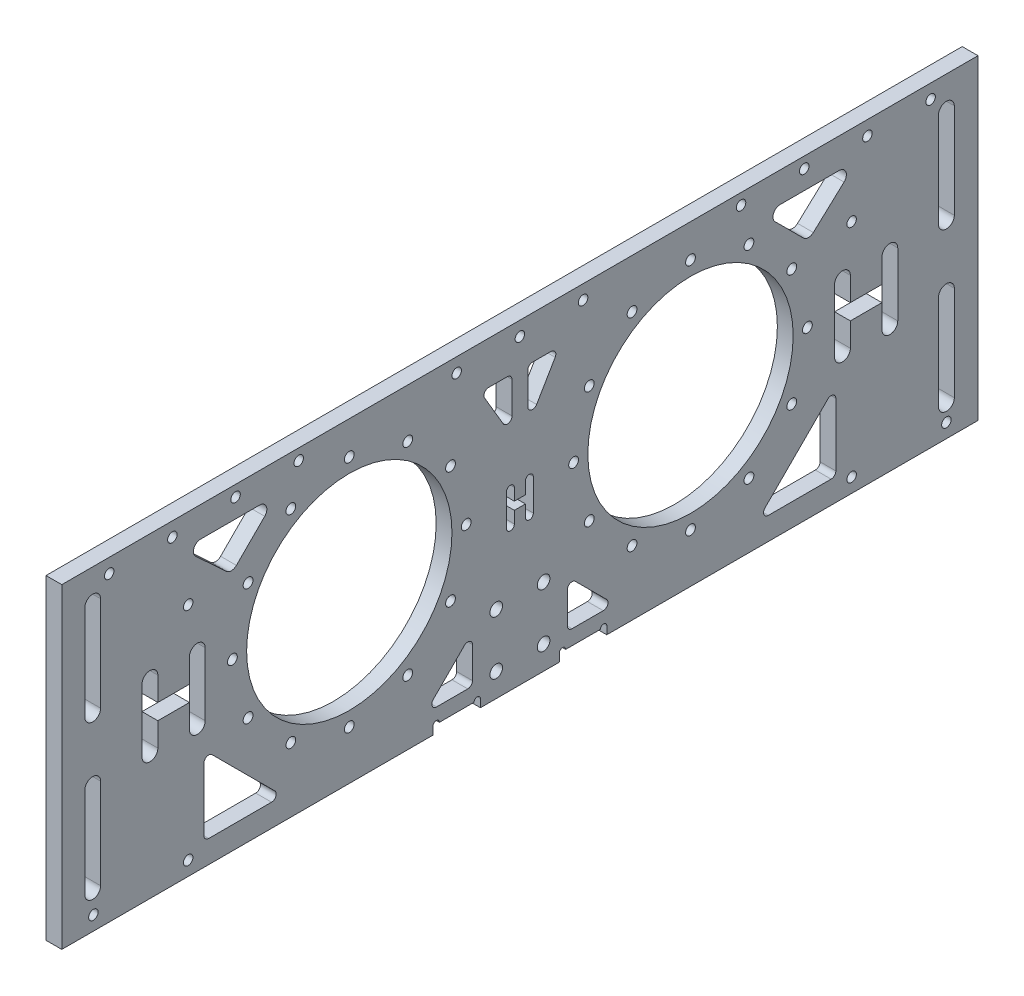
from build123d import *

# Parameters (mm, degrees)
SKETCH_1_W          = 288
SKETCH_1_H          = 101
SKETCH_1_R          = 32.5
SKETCH_1_R_2        = 1.55
SKETCH_1_R_3        = 2
SKETCH_1_R_4        = 1.5
EXTRUDE_1_DEPTH     = 5
SKETCH_2_R          = 1.5
CUT_EXTRUDE_1_DEPTH = 206.031704865
SKETCH_3_R          = 1.5
CUT_EXTRUDE_2_DEPTH = 10
CUT_EXTRUDE_3_DEPTH = 206.031704865
CUT_EXTRUDE_4_DEPTH = 206.031704865
SKETCH_8_W          = 1
SKETCH_8_H          = 101
EXTRUDE_3_DEPTH     = 5
SKETCH_9_W          = 290
SKETCH_9_H          = 0.5
CUT_EXTRUDE_5_DEPTH = 10
CUT_EXTRUDE_6_DEPTH = 10
CUT_EXTRUDE_7_DEPTH = 10
CUT_EXTRUDE_8_DEPTH = 10


with BuildPart() as part:
    # 草图1 → 凸台-拉伸1 (new body)
    with BuildSketch(Plane(origin=(0, 0, 0), x_dir=(0, 0, -1), z_dir=(1, 0, 0))):
        with Locations((54, -2.5)):
            Rectangle(SKETCH_1_W, SKETCH_1_H)
        Circle(SKETCH_1_R, mode=Mode.SUBTRACT)
        with Locations((0, 37)):
            Circle(SKETCH_1_R_2, mode=Mode.SUBTRACT)
        with Locations((18.5, 32.04293994)):
            Circle(SKETCH_1_R_2, mode=Mode.SUBTRACT)
        with Locations((32.04293994, 18.5)):
            Circle(SKETCH_1_R_2, mode=Mode.SUBTRACT)
        with Locations((37, 0)):
            Circle(SKETCH_1_R_2, mode=Mode.SUBTRACT)
        with Locations((32.04293994, -18.5)):
            Circle(SKETCH_1_R_2, mode=Mode.SUBTRACT)
        with Locations((18.5, -32.04293994)):
            Circle(SKETCH_1_R_2, mode=Mode.SUBTRACT)
        with Locations((0, -37)):
            Circle(SKETCH_1_R_2, mode=Mode.SUBTRACT)
        with Locations((-18.5, -32.04293994)):
            Circle(SKETCH_1_R_2, mode=Mode.SUBTRACT)
        with Locations((-32.04293994, -18.5)):
            Circle(SKETCH_1_R_2, mode=Mode.SUBTRACT)
        with Locations((-37, 0)):
            Circle(SKETCH_1_R_2, mode=Mode.SUBTRACT)
        with Locations((-32.04293994, 18.5)):
            Circle(SKETCH_1_R_2, mode=Mode.SUBTRACT)
        with Locations((-18.5, 32.04293994)):
            Circle(SKETCH_1_R_2, mode=Mode.SUBTRACT)
        with Locations(Location((126.5, 32.04293994, 0), (0, 0, 180))):
            Circle(SKETCH_1_R_2, mode=Mode.SUBTRACT)
        with Locations(Location((140.04293994, 18.5, 0), (0, 0, 180))):
            Circle(SKETCH_1_R_2, mode=Mode.SUBTRACT)
        with Locations(Location((145, 0, 0), (0, 0, 180))):
            Circle(SKETCH_1_R_2, mode=Mode.SUBTRACT)
        with Locations(Location((140.04293994, -18.5, 0), (0, 0, 180))):
            Circle(SKETCH_1_R_2, mode=Mode.SUBTRACT)
        with Locations(Location((126.5, -32.04293994, 0), (0, 0, 180))):
            Circle(SKETCH_1_R_2, mode=Mode.SUBTRACT)
        with Locations(Location((108, -37, 0), (0, 0, 180))):
            Circle(SKETCH_1_R_2, mode=Mode.SUBTRACT)
        with Locations(Location((89.5, -32.04293994, 0), (0, 0, 180))):
            Circle(SKETCH_1_R_2, mode=Mode.SUBTRACT)
        with Locations(Location((75.95706006, -18.5, 0), (0, 0, 180))):
            Circle(SKETCH_1_R_2, mode=Mode.SUBTRACT)
        with Locations(Location((71, 0, 0), (0, 0, 180))):
            Circle(SKETCH_1_R_2, mode=Mode.SUBTRACT)
        with Locations(Location((75.95706006, 18.5, 0), (0, 0, 180))):
            Circle(SKETCH_1_R_2, mode=Mode.SUBTRACT)
        with Locations(Location((89.5, 32.04293994, 0), (0, 0, 180))):
            Circle(SKETCH_1_R_2, mode=Mode.SUBTRACT)
        with Locations(Location((108, 37, 0), (0, 0, 180))):
            Circle(SKETCH_1_R_2, mode=Mode.SUBTRACT)
        with Locations(Location((108, 0, 0), (0, 0, 180))):
            Circle(SKETCH_1_R, mode=Mode.SUBTRACT)
        with Locations((61.5, -28)):
            Circle(SKETCH_1_R_3, mode=Mode.SUBTRACT)
        with Locations((46.5, -28)):
            Circle(SKETCH_1_R_3, mode=Mode.SUBTRACT)
        with Locations((46.5, -45)):
            Circle(SKETCH_1_R_3, mode=Mode.SUBTRACT)
        with Locations((61.5, -45)):
            Circle(SKETCH_1_R_3, mode=Mode.SUBTRACT)
        with Locations((-16, 44)):
            Circle(SKETCH_1_R_4, mode=Mode.SUBTRACT)
        with Locations((-36, 44)):
            Circle(SKETCH_1_R_4, mode=Mode.SUBTRACT)
        with Locations(Location((124, 44, 0), (0, 0, 180))):
            Circle(SKETCH_1_R_4, mode=Mode.SUBTRACT)
        with Locations(Location((144, 44, 0), (0, 0, 180))):
            Circle(SKETCH_1_R_4, mode=Mode.SUBTRACT)
    extrude(amount=EXTRUDE_1_DEPTH)

    # 草图2 → 切除-拉伸1 (cut, through all)
    with BuildSketch(Plane(origin=(5, 0, 0), x_dir=(0, 0, -1), z_dir=(1, 0, 0))):
        with Locations((-76, 43)):
            Circle(SKETCH_2_R)
        with Locations((-56, 43)):
            Circle(SKETCH_2_R)
        with Locations(Location((164, 43, 0), (0, 0, 180))):
            Circle(SKETCH_2_R)
        with Locations(Location((184, 43, 0), (0, 0, 180))):
            Circle(SKETCH_2_R)
        with Locations((34, 43)):
            Circle(SKETCH_2_R)
        with Locations((54, 43)):
            Circle(SKETCH_2_R)
        with Locations(Location((74, 43, 0), (0, 0, 180))):
            Circle(SKETCH_2_R)
    extrude(amount=-CUT_EXTRUDE_1_DEPTH, mode=Mode.SUBTRACT)

    # 草图3 → 切除-拉伸2 (cut)
    with BuildSketch(Plane(origin=(5, 0, 0), x_dir=(0, 0, -1), z_dir=(1, 0, 0))):
        with Locations((-81, -48)):
            Circle(SKETCH_3_R)
        with Locations((-51, -48)):
            Circle(SKETCH_3_R)
        with Locations((-81, 22)):
            Circle(SKETCH_3_R)
        with Locations((-51, 22)):
            Circle(SKETCH_3_R)
        with Locations(Location((159, 22, 0), (0, 0, 180))):
            Circle(SKETCH_3_R)
        with Locations(Location((189, 22, 0), (0, 0, 180))):
            Circle(SKETCH_3_R)
        with Locations(Location((159, -48, 0), (0, 0, 180))):
            Circle(SKETCH_3_R)
        with Locations(Location((189, -48, 0), (0, 0, 180))):
            Circle(SKETCH_3_R)
    extrude(amount=-CUT_EXTRUDE_2_DEPTH, mode=Mode.SUBTRACT)

    # 草图4 → 切除-拉伸3 (cut, through all)
    with BuildSketch(Plane(origin=(5, 0, 0), x_dir=(0, 0, -1), z_dir=(1, 0, 0))):
        with BuildLine():
            Line((44.122624964, 34), (50, 34))
            ThreePointArc((50, 34), (51.060660172, 33.560660172), (51.5, 32.5))
            Line((51.5, 32.5), (51.5, 22.508462438))
            ThreePointArc((51.5, 22.508462438), (50.394111669, 21.061162887), (48.707098677, 21.747932249))
            Line((48.707098677, 21.747932249), (42.829723641, 31.73946981))
            ThreePointArc((42.829723641, 31.73946981), (42.820550603, 33.244716293), (44.122624964, 34))
        make_face()
        with BuildLine():
            Line((56.5, 32.5), (56.5, 22.508462438))
            ThreePointArc((56.5, 22.508462438), (57.605888331, 21.061162887), (59.292901323, 21.747932249))
            Line((59.292901323, 21.747932249), (65.170276359, 31.73946981))
            ThreePointArc((65.170276359, 31.73946981), (65.179449397, 33.244716293), (63.877375036, 34))
            Line((63.877375036, 34), (58, 34))
            ThreePointArc((58, 34), (56.939339828, 33.560660172), (56.5, 32.5))
        make_face()
        with BuildLine():
            Line((-46, -23.948975277), (-46, -43.827654933))
            ThreePointArc((-46, -43.827654933), (-45.560660172, -44.888315105), (-44.5, -45.327654933))
            Line((-44.5, -45.327654933), (-24.621320344, -45.327654933))
            ThreePointArc((-24.621320344, -45.327654933), (-23.235501045, -44.401680082), (-23.560660172, -42.766994761))
            Line((-23.560660172, -42.766994761), (-43.439339828, -22.888315105))
            ThreePointArc((-43.439339828, -22.888315105), (-45.074025149, -22.563155978), (-46, -23.948975277))
        make_face()
        with BuildLine():
            Line((-47.066345444, 38), (-28.373089162, 38))
            ThreePointArc((-28.373089162, 38), (-26.272536009, 36.596455255), (-26.765395381, 34.11868387))
            Line((-26.765395381, 34.11868387), (-35.735317727, 25.148761524))
            ThreePointArc((-35.735317727, 25.148761524), (-37.297221437, 24.483294102), (-38.884657298, 25.085321904))
            Line((-38.884657298, 25.085321904), (-48.607991234, 34.05524425))
            ThreePointArc((-48.607991234, 34.05524425), (-49.183995655, 36.553974273), (-47.066345444, 38))
        make_face()
        with BuildLine():
            Line((27.621320344, -45.327654933), (37.5, -45.327654933))
            ThreePointArc((37.5, -45.327654933), (38.560660172, -44.888315105), (39, -43.827654933))
            Line((39, -43.827654933), (39, -33.948975277))
            ThreePointArc((39, -33.948975277), (38.074025149, -32.563155978), (36.439339828, -32.888315105))
            Line((36.439339828, -32.888315105), (26.560660172, -42.766994761))
            ThreePointArc((26.560660172, -42.766994761), (26.235501045, -44.401680082), (27.621320344, -45.327654933))
        make_face()
        with BuildLine():
            Line((71.560660172, -32.888315105), (81.439339828, -42.766994761))
            ThreePointArc((81.439339828, -42.766994761), (81.764498955, -44.401680082), (80.378679656, -45.327654933))
            Line((80.378679656, -45.327654933), (70.5, -45.327654933))
            ThreePointArc((70.5, -45.327654933), (69.439339828, -44.888315105), (69, -43.827654933))
            Line((69, -43.827654933), (69, -33.948975277))
            ThreePointArc((69, -33.948975277), (69.925974851, -32.563155978), (71.560660172, -32.888315105))
        make_face()
        with BuildLine():
            Line((146.884657298, 25.085321904), (156.607991234, 34.05524425))
            ThreePointArc((156.607991234, 34.05524425), (157.183995655, 36.553974273), (155.066345444, 38))
            Line((155.066345444, 38), (136.373089162, 38))
            ThreePointArc((136.373089162, 38), (134.272536009, 36.596455255), (134.765395381, 34.11868387))
            Line((134.765395381, 34.11868387), (143.735317727, 25.148761524))
            ThreePointArc((143.735317727, 25.148761524), (145.297221437, 24.483294102), (146.884657298, 25.085321904))
        make_face()
        with BuildLine():
            Line((131.560660172, -42.766994761), (151.439339828, -22.888315105))
            ThreePointArc((151.439339828, -22.888315105), (153.074025149, -22.563155978), (154, -23.948975277))
            Line((154, -23.948975277), (154, -43.827654933))
            ThreePointArc((154, -43.827654933), (153.560660172, -44.888315105), (152.5, -45.327654933))
            Line((152.5, -45.327654933), (132.621320344, -45.327654933))
            ThreePointArc((132.621320344, -45.327654933), (131.235501045, -44.401680082), (131.560660172, -42.766994761))
        make_face()
    extrude(amount=-CUT_EXTRUDE_3_DEPTH, mode=Mode.SUBTRACT)

    # 草图6 → 切除-拉伸4 (cut, through all)
    with BuildSketch(Plane(origin=(5, 0, 0), x_dir=(0, 0, -1), z_dir=(1, 0, 0))):
        with BuildLine():
            Line((41.5, -53), (41.5, -50))
            ThreePointArc((41.5, -50), (40.5, -49), (39.5, -50))
            Line((39.5, -50), (28.5, -50))
            ThreePointArc((28.5, -50), (27.5, -49), (26.5, -50))
            Line((26.5, -50), (26.5, -53))
            Line((26.5, -53), (41.5, -53))
        make_face()
        with BuildLine():
            Line((81.5, -53), (66.5, -53))
            Line((66.5, -53), (66.5, -50))
            ThreePointArc((66.5, -50), (67.5, -49), (68.5, -50))
            Line((68.5, -50), (79.5, -50))
            ThreePointArc((79.5, -50), (80.5, -49), (81.5, -50))
            Line((81.5, -50), (81.5, -53))
        make_face()
    extrude(amount=-CUT_EXTRUDE_4_DEPTH, mode=Mode.SUBTRACT)

    # 草图8 → 凸台-拉伸3 (add)
    with BuildSketch(Plane(origin=(5, 0, 0), x_dir=(0, 0, -1), z_dir=(1, 0, 0))):
        with Locations((-90.5, -2.5)):
            Rectangle(SKETCH_8_W, SKETCH_8_H)
        with Locations((198.5, -2.5)):
            Rectangle(SKETCH_8_W, SKETCH_8_H)
    extrude(amount=-EXTRUDE_3_DEPTH)

    # 草图9 → 切除-拉伸5 (cut)
    with BuildSketch(Plane(origin=(5, 0, 0), x_dir=(0, 0, -1), z_dir=(1, 0, 0))):
        with Locations((54, 47.75)):
            Rectangle(SKETCH_9_W, SKETCH_9_H)
        with Locations((54, -52.75)):
            Rectangle(SKETCH_9_W, SKETCH_9_H)
    extrude(amount=-CUT_EXTRUDE_5_DEPTH, mode=Mode.SUBTRACT)

    # 草图10 → 切除-拉伸6 (cut)
    with BuildSketch(Plane.ZY):
        with BuildLine():
            Line((78.714402217, 7.5), (78.714402217, 37.5))
            ThreePointArc((78.714402217, 37.5), (81.214402217, 40), (83.714402217, 37.5))
            Line((83.714402217, 37.5), (83.714402217, 7.5))
            ThreePointArc((83.714402217, 7.5), (81.214402217, 5), (78.714402217, 7.5))
        make_face()
        with BuildLine():
            Line((83.714402217, -12.5), (83.714402217, -41.175392691))
            ThreePointArc((83.714402217, -41.175392691), (81.214402217, -43.675392691), (78.714402217, -41.175392691))
            Line((78.714402217, -41.175392691), (78.714402217, -12.5))
            ThreePointArc((78.714402217, -12.5), (81.214402217, -10), (83.714402217, -12.5))
        make_face()
        with BuildLine():
            Line((-191.5, 7.5), (-191.5, 37.5))
            ThreePointArc((-191.5, 37.5), (-189, 40), (-186.5, 37.5))
            Line((-186.5, 37.5), (-186.5, 7.5))
            ThreePointArc((-186.5, 7.5), (-189, 5), (-191.5, 7.5))
        make_face()
        with BuildLine():
            Line((-186.5, -12.5), (-186.5, -42.5))
            ThreePointArc((-186.5, -42.5), (-189, -45), (-191.5, -42.5))
            Line((-191.5, -42.5), (-191.5, -12.5))
            ThreePointArc((-191.5, -12.5), (-189, -10), (-186.5, -12.5))
        make_face()
    extrude(amount=-CUT_EXTRUDE_6_DEPTH, mode=Mode.SUBTRACT)

    # 草图11 → 切除-拉伸7 (cut)
    with BuildSketch(Plane.ZY):
        with BuildLine():
            Line((-153.600792494, -12.5), (-153.600792494, 7.5))
            ThreePointArc((-153.600792494, 7.5), (-156.100792494, 10), (-158.600792494, 7.5))
            Line((-158.600792494, 7.5), (-158.600792494, 0))
            Line((-158.600792494, 0), (-168.600792494, 0))
            Line((-168.600792494, 0), (-168.600792494, 7.5))
            ThreePointArc((-168.600792494, 7.5), (-171.100792494, 10), (-173.600792494, 7.5))
            Line((-173.600792494, 7.5), (-173.600792494, -12.5))
            ThreePointArc((-173.600792494, -12.5), (-171.100792494, -15), (-168.600792494, -12.5))
            Line((-168.600792494, -12.5), (-168.600792494, -5))
            Line((-168.600792494, -5), (-158.600792494, -5))
            Line((-158.600792494, -5), (-158.600792494, -12.5))
            ThreePointArc((-158.600792494, -12.5), (-156.100792494, -15), (-153.600792494, -12.5))
        make_face()
        with BuildLine():
            ThreePointArc((50.600792494, 7.5), (48.100792494, 10), (45.600792494, 7.5))
            Line((45.600792494, 7.5), (45.600792494, -12.5))
            ThreePointArc((45.600792494, -12.5), (48.100792494, -15), (50.600792494, -12.5))
            Line((50.600792494, -12.5), (50.600792494, -5))
            Line((50.600792494, -5), (60.600792494, -5))
            Line((60.600792494, -5), (60.600792494, -12.5))
            ThreePointArc((60.600792494, -12.5), (63.100792494, -15), (65.600792494, -12.5))
            Line((65.600792494, -12.5), (65.600792494, 7.5))
            ThreePointArc((65.600792494, 7.5), (63.100792494, 10), (60.600792494, 7.5))
            Line((60.600792494, 7.5), (60.600792494, 0))
            Line((60.600792494, 0), (50.600792494, 0))
            Line((50.600792494, 0), (50.600792494, 7.5))
        make_face()
    extrude(amount=-CUT_EXTRUDE_7_DEPTH, mode=Mode.SUBTRACT)

    # 草图12 → 切除-拉伸8 (cut)
    with BuildSketch(Plane(origin=(5, 0, 0), x_dir=(0, 0, -1), z_dir=(1, 0, 0))):
        with BuildLine():
            Line((52.25, 2.5), (52.25, -1.25))
            Line((52.25, -1.25), (55.75, -1.25))
            Line((55.75, -1.25), (55.75, 2.5))
            ThreePointArc((55.75, 2.5), (57, 3.75), (58.25, 2.5))
            Line((58.25, 2.5), (58.25, -7.5))
            ThreePointArc((58.25, -7.5), (57, -8.75), (55.75, -7.5))
            Line((55.75, -7.5), (55.75, -3.75))
            Line((55.75, -3.75), (52.25, -3.75))
            Line((52.25, -3.75), (52.25, -7.5))
            ThreePointArc((52.25, -7.5), (51, -8.75), (49.75, -7.5))
            Line((49.75, -7.5), (49.75, 2.5))
            ThreePointArc((49.75, 2.5), (51, 3.75), (52.25, 2.5))
        make_face()
    extrude(amount=-CUT_EXTRUDE_8_DEPTH, mode=Mode.SUBTRACT)


solid = part.part
